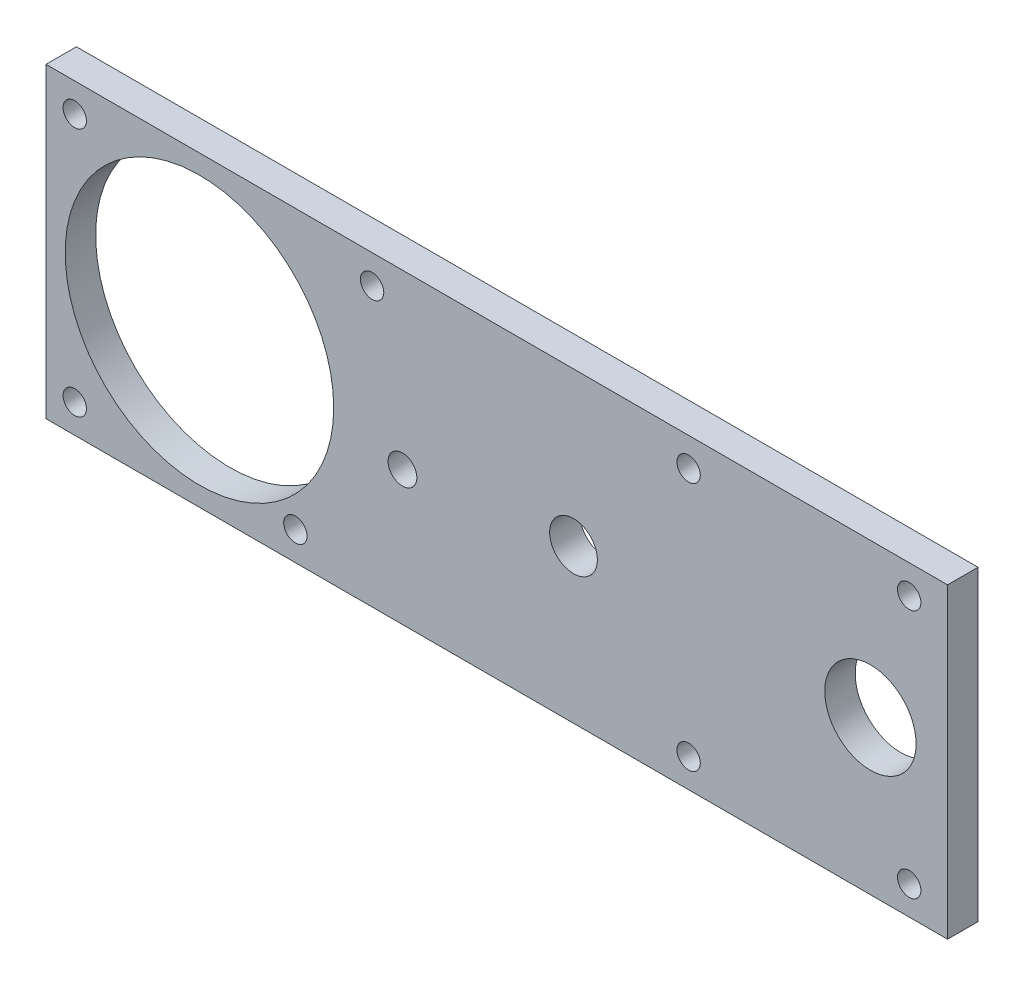
from build123d import *

# Parameters (mm, degrees)
SKETCH1_W             = 93.99999996
SKETCH1_H             = 32
SKETCH1_R             = 2.4892
SKETCH1_R_2           = 1.4986
SKETCH1_R_3           = 14
BOSS_EXTRUDE2_DEPTH   = 3.175
F_2_CLEARANCE_HOLE1_D = 2.4384
SKETCH5_R             = 4.7625
CUT_EXTRUDE1_DEPTH    = 100.348279389


with BuildPart() as part:
    # Sketch1 → Boss-Extrude2 (new body)
    with BuildSketch(Plane.XY):
        with Locations((46.99999998, 16)):
            Rectangle(SKETCH1_W, SKETCH1_H)
        with Locations((55, 16)):
            Circle(SKETCH1_R, mode=Mode.SUBTRACT)
        with Locations((37.166699296, 14)):
            Circle(SKETCH1_R_2, mode=Mode.SUBTRACT)
        with Locations((16, 16)):
            Circle(SKETCH1_R_3, mode=Mode.SUBTRACT)
    extrude(amount=BOSS_EXTRUDE2_DEPTH)

    # #2 Clearance Hole1 (through all)
    with Locations(Plane.XY.offset(3.175)):
        with Locations((90, 3), (90, 29), (3, 29), (3, 3), (34, 29), (26, 3), (67, 3), (67, 29)):
            Hole(F_2_CLEARANCE_HOLE1_D / 2)

    # Sketch5 → Cut-Extrude1 (cut, through all)
    with BuildSketch(Plane.XY.offset(3.175)):
        with Locations((85.9562, 16)):
            Circle(SKETCH5_R)
    extrude(amount=-CUT_EXTRUDE1_DEPTH, mode=Mode.SUBTRACT)


solid = part.part
